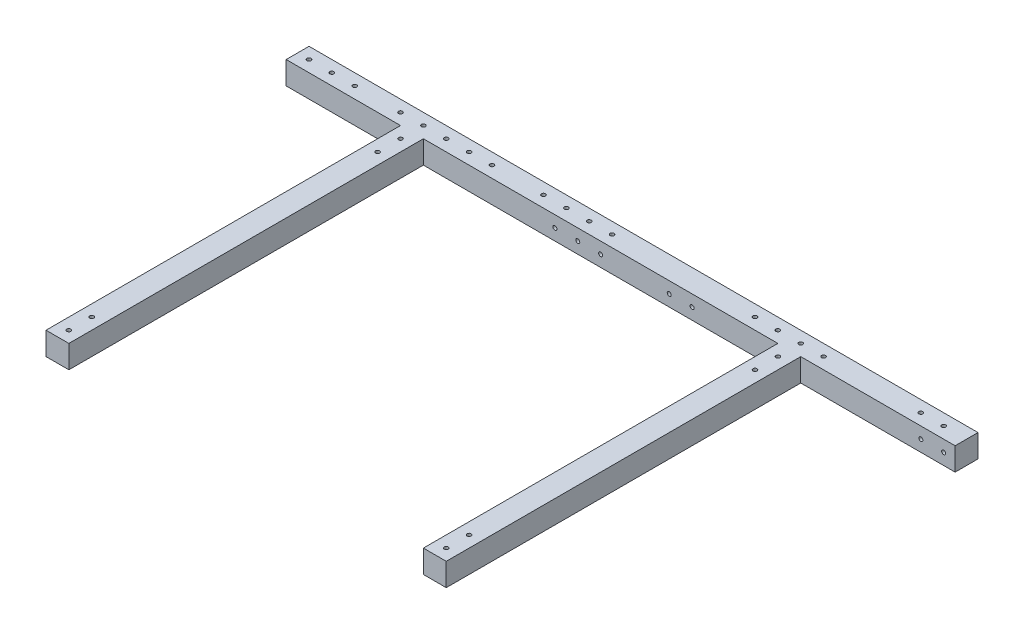
from build123d import *

# Parameters (mm, degrees)
SKETCH_1_W          = 350
SKETCH_1_H          = 20
SKETCH_1_W_2        = 20
SKETCH_1_H_2        = 310
SKETCH_1_W_3        = 100
EXTRUDE_1_DEPTH     = 20
CUT_EXTRUDE_1_REACH = 424.404
SKETCH_2_R          = 1.75
SKETCH_3_W          = 20
SKETCH_3_H          = 20
EXTRUDE_2_DEPTH     = 135
SKETCH_4_R          = 1.75
CUT_EXTRUDE_2_DEPTH = 20
CUT_EXTRUDE_3_REACH = 455.211
SKETCH_5_R          = 1.75
CUT_EXTRUDE_4_REACH = 455.211
SKETCH_6_R          = 1.75
SKETCH_7_R          = 1.75
CUT_EXTRUDE_5_DEPTH = 20
SKETCH_8_R          = 1.75
CUT_EXTRUDE_6_DEPTH = 20


with BuildPart() as part:
    # 草图1 → 凸台-拉伸1 (new body)
    with BuildSketch(Plane(origin=(0, 0, 0), x_dir=(1, 0, 0), z_dir=(0, 1, 0))):
        Rectangle(SKETCH_1_W, SKETCH_1_H)
        with Locations((-165, -165)):
            Rectangle(SKETCH_1_W_2, SKETCH_1_H_2)
        with Locations((165, -165)):
            Rectangle(SKETCH_1_W_2, SKETCH_1_H_2)
        with Locations((-225, 0)):
            Rectangle(SKETCH_1_W_3, SKETCH_1_H)
    extrude(amount=EXTRUDE_1_DEPTH)

    # 草图2 → 切除-拉伸1 (cut, up to next)
    with BuildSketch(Plane(origin=(0, 20, 0), x_dir=(1, 0, 0), z_dir=(0, 1, 0)), mode=Mode.PRIVATE) as cut_extrude_1_sk1:
        with Locations(Location((-145, 0, 0), (0, 0, 270))):
            Circle(SKETCH_2_R)
    cut_extrude_1_tool1 = extrude(cut_extrude_1_sk1.sketch, amount=-CUT_EXTRUDE_1_REACH, mode=Mode.PRIVATE) & part.part
    # 草图2 → 切除-拉伸1 (cut, up to next)
    with BuildSketch(Plane(origin=(0, 20, 0), x_dir=(1, 0, 0), z_dir=(0, 1, 0)), mode=Mode.PRIVATE) as cut_extrude_1_sk2:
        with Locations(Location((-125, 0, 0), (0, 0, 270))):
            Circle(SKETCH_2_R)
    cut_extrude_1_tool2 = extrude(cut_extrude_1_sk2.sketch, amount=-CUT_EXTRUDE_1_REACH, mode=Mode.PRIVATE) & part.part
    # 草图2 → 切除-拉伸1 (cut, up to next)
    with BuildSketch(Plane(origin=(0, 20, 0), x_dir=(1, 0, 0), z_dir=(0, 1, 0)), mode=Mode.PRIVATE) as cut_extrude_1_sk3:
        with Locations(Location((-165, -310, 0), (0, 0, 270))):
            Circle(SKETCH_2_R)
    cut_extrude_1_tool3 = extrude(cut_extrude_1_sk3.sketch, amount=-CUT_EXTRUDE_1_REACH, mode=Mode.PRIVATE) & part.part
    # 草图2 → 切除-拉伸1 (cut, up to next)
    with BuildSketch(Plane(origin=(0, 20, 0), x_dir=(1, 0, 0), z_dir=(0, 1, 0)), mode=Mode.PRIVATE) as cut_extrude_1_sk4:
        with Locations(Location((125, 0, 0), (0, 0, 270))):
            Circle(SKETCH_2_R)
    cut_extrude_1_tool4 = extrude(cut_extrude_1_sk4.sketch, amount=-CUT_EXTRUDE_1_REACH, mode=Mode.PRIVATE) & part.part
    # 草图2 → 切除-拉伸1 (cut, up to next)
    with BuildSketch(Plane(origin=(0, 20, 0), x_dir=(1, 0, 0), z_dir=(0, 1, 0)), mode=Mode.PRIVATE) as cut_extrude_1_sk5:
        with Locations(Location((145, 0, 0), (0, 0, 270))):
            Circle(SKETCH_2_R)
    cut_extrude_1_tool5 = extrude(cut_extrude_1_sk5.sketch, amount=-CUT_EXTRUDE_1_REACH, mode=Mode.PRIVATE) & part.part
    # 草图2 → 切除-拉伸1 (cut, up to next)
    with BuildSketch(Plane(origin=(0, 20, 0), x_dir=(1, 0, 0), z_dir=(0, 1, 0)), mode=Mode.PRIVATE) as cut_extrude_1_sk6:
        with Locations(Location((165, 0, 0), (0, 0, 270))):
            Circle(SKETCH_2_R)
    cut_extrude_1_tool6 = extrude(cut_extrude_1_sk6.sketch, amount=-CUT_EXTRUDE_1_REACH, mode=Mode.PRIVATE) & part.part
    # 草图2 → 切除-拉伸1 (cut, up to next)
    with BuildSketch(Plane(origin=(0, 20, 0), x_dir=(1, 0, 0), z_dir=(0, 1, 0)), mode=Mode.PRIVATE) as cut_extrude_1_sk7:
        with Locations(Location((165, -20, 0), (0, 0, 270))):
            Circle(SKETCH_2_R)
    cut_extrude_1_tool7 = extrude(cut_extrude_1_sk7.sketch, amount=-CUT_EXTRUDE_1_REACH, mode=Mode.PRIVATE) & part.part
    # 草图2 → 切除-拉伸1 (cut, up to next)
    with BuildSketch(Plane(origin=(0, 20, 0), x_dir=(1, 0, 0), z_dir=(0, 1, 0)), mode=Mode.PRIVATE) as cut_extrude_1_sk8:
        with Locations(Location((165, -290, 0), (0, 0, 270))):
            Circle(SKETCH_2_R)
    cut_extrude_1_tool8 = extrude(cut_extrude_1_sk8.sketch, amount=-CUT_EXTRUDE_1_REACH, mode=Mode.PRIVATE) & part.part
    # 草图2 → 切除-拉伸1 (cut, up to next)
    with BuildSketch(Plane(origin=(0, 20, 0), x_dir=(1, 0, 0), z_dir=(0, 1, 0)), mode=Mode.PRIVATE) as cut_extrude_1_sk9:
        with Locations(Location((165, -310, 0), (0, 0, 270))):
            Circle(SKETCH_2_R)
    cut_extrude_1_tool9 = extrude(cut_extrude_1_sk9.sketch, amount=-CUT_EXTRUDE_1_REACH, mode=Mode.PRIVATE) & part.part
    # 草图2 → 切除-拉伸1 (cut, up to next)
    with BuildSketch(Plane(origin=(0, 20, 0), x_dir=(1, 0, 0), z_dir=(0, 1, 0)), mode=Mode.PRIVATE) as cut_extrude_1_sk10:
        with Locations(Location((-105, 0, 0), (0, 0, 270))):
            Circle(SKETCH_2_R)
    cut_extrude_1_tool10 = extrude(cut_extrude_1_sk10.sketch, amount=-CUT_EXTRUDE_1_REACH, mode=Mode.PRIVATE) & part.part
    # 草图2 → 切除-拉伸1 (cut, up to next)
    with BuildSketch(Plane(origin=(0, 20, 0), x_dir=(1, 0, 0), z_dir=(0, 1, 0)), mode=Mode.PRIVATE) as cut_extrude_1_sk11:
        with Locations(Location((-165, 0, 0), (0, 0, 270))):
            Circle(SKETCH_2_R)
    cut_extrude_1_tool11 = extrude(cut_extrude_1_sk11.sketch, amount=-CUT_EXTRUDE_1_REACH, mode=Mode.PRIVATE) & part.part
    # 草图2 → 切除-拉伸1 (cut, up to next)
    with BuildSketch(Plane(origin=(0, 20, 0), x_dir=(1, 0, 0), z_dir=(0, 1, 0)), mode=Mode.PRIVATE) as cut_extrude_1_sk12:
        with Locations(Location((-165, -20, 0), (0, 0, 270))):
            Circle(SKETCH_2_R)
    cut_extrude_1_tool12 = extrude(cut_extrude_1_sk12.sketch, amount=-CUT_EXTRUDE_1_REACH, mode=Mode.PRIVATE) & part.part
    # 草图2 → 切除-拉伸1 (cut, up to next)
    with BuildSketch(Plane(origin=(0, 20, 0), x_dir=(1, 0, 0), z_dir=(0, 1, 0)), mode=Mode.PRIVATE) as cut_extrude_1_sk13:
        with Locations(Location((-165, -290, 0), (0, 0, 270))):
            Circle(SKETCH_2_R)
    cut_extrude_1_tool13 = extrude(cut_extrude_1_sk13.sketch, amount=-CUT_EXTRUDE_1_REACH, mode=Mode.PRIVATE) & part.part
    # 草图2 → 切除-拉伸1 (cut, up to next)
    with BuildSketch(Plane(origin=(0, 20, 0), x_dir=(1, 0, 0), z_dir=(0, 1, 0)), mode=Mode.PRIVATE) as cut_extrude_1_sk14:
        with Locations(Location((-185, 0, 0), (0, 0, 270))):
            Circle(SKETCH_2_R)
    cut_extrude_1_tool14 = extrude(cut_extrude_1_sk14.sketch, amount=-CUT_EXTRUDE_1_REACH, mode=Mode.PRIVATE) & part.part
    # 草图2 → 切除-拉伸1 (cut, up to next)
    with BuildSketch(Plane(origin=(0, 20, 0), x_dir=(1, 0, 0), z_dir=(0, 1, 0)), mode=Mode.PRIVATE) as cut_extrude_1_sk15:
        with Locations(Location((-165, -40, 0), (0, 0, 270))):
            Circle(SKETCH_2_R)
    cut_extrude_1_tool15 = extrude(cut_extrude_1_sk15.sketch, amount=-CUT_EXTRUDE_1_REACH, mode=Mode.PRIVATE) & part.part
    add(cut_extrude_1_tool1.solids().sort_by_distance((-145, 20, 0))[0], mode=Mode.SUBTRACT)
    add(cut_extrude_1_tool2.solids().sort_by_distance((-125, 20, 0))[0], mode=Mode.SUBTRACT)
    add(cut_extrude_1_tool3.solids().sort_by_distance((-165, 20, 310))[0], mode=Mode.SUBTRACT)
    add(cut_extrude_1_tool4.solids().sort_by_distance((125, 20, 0))[0], mode=Mode.SUBTRACT)
    add(cut_extrude_1_tool5.solids().sort_by_distance((145, 20, 0))[0], mode=Mode.SUBTRACT)
    add(cut_extrude_1_tool6.solids().sort_by_distance((165, 20, 0))[0], mode=Mode.SUBTRACT)
    add(cut_extrude_1_tool7.solids().sort_by_distance((165, 20, 20))[0], mode=Mode.SUBTRACT)
    add(cut_extrude_1_tool8.solids().sort_by_distance((165, 20, 290))[0], mode=Mode.SUBTRACT)
    add(cut_extrude_1_tool9.solids().sort_by_distance((165, 20, 310))[0], mode=Mode.SUBTRACT)
    add(cut_extrude_1_tool10.solids().sort_by_distance((-105, 20, 0))[0], mode=Mode.SUBTRACT)
    add(cut_extrude_1_tool11.solids().sort_by_distance((-165, 20, 0))[0], mode=Mode.SUBTRACT)
    add(cut_extrude_1_tool12.solids().sort_by_distance((-165, 20, 20))[0], mode=Mode.SUBTRACT)
    add(cut_extrude_1_tool13.solids().sort_by_distance((-165, 20, 290))[0], mode=Mode.SUBTRACT)
    add(cut_extrude_1_tool14.solids().sort_by_distance((-185, 20, 0))[0], mode=Mode.SUBTRACT)
    add(cut_extrude_1_tool15.solids().sort_by_distance((-165, 20, 40))[0], mode=Mode.SUBTRACT)

    # 草图3 → 凸台-拉伸2 (add)
    with BuildSketch(Plane(origin=(175, 0, 0), x_dir=(0, 0, -1), z_dir=(1, 0, 0))):
        with Locations((0, 10)):
            Rectangle(SKETCH_3_W, SKETCH_3_H)
    extrude(amount=EXTRUDE_2_DEPTH)

    # 草图4 → 切除-拉伸2 (cut)
    with BuildSketch(Plane(origin=(0, 20, 0), x_dir=(1, 0, 0), z_dir=(0, 1, 0))):
        with Locations(Location((165, -40, 0), (0, 0, 270))):
            Circle(SKETCH_4_R)
        with Locations(Location((185, 0, 0), (0, 0, 270))):
            Circle(SKETCH_4_R)
    extrude(amount=-CUT_EXTRUDE_2_DEPTH, mode=Mode.SUBTRACT)

    # 草图5 → 切除-拉伸3 (cut, up to next)
    with BuildSketch(Plane(origin=(0, 0, -10), x_dir=(-1, 0, 0), z_dir=(0, 0, -1)), mode=Mode.PRIVATE) as cut_extrude_3_sk1:
        with Locations((40, 10)):
            Circle(SKETCH_5_R)
    cut_extrude_3_tool1 = extrude(cut_extrude_3_sk1.sketch, amount=-CUT_EXTRUDE_3_REACH, mode=Mode.PRIVATE) & part.part
    # 草图5 → 切除-拉伸3 (cut, up to next)
    with BuildSketch(Plane(origin=(0, 0, -10), x_dir=(-1, 0, 0), z_dir=(0, 0, -1)), mode=Mode.PRIVATE) as cut_extrude_3_sk2:
        with Locations((20, 10)):
            Circle(SKETCH_5_R)
    cut_extrude_3_tool2 = extrude(cut_extrude_3_sk2.sketch, amount=-CUT_EXTRUDE_3_REACH, mode=Mode.PRIVATE) & part.part
    # 草图5 → 切除-拉伸3 (cut, up to next)
    with BuildSketch(Plane(origin=(0, 0, -10), x_dir=(-1, 0, 0), z_dir=(0, 0, -1)), mode=Mode.PRIVATE) as cut_extrude_3_sk3:
        with Locations((0, 10)):
            Circle(SKETCH_5_R)
    cut_extrude_3_tool3 = extrude(cut_extrude_3_sk3.sketch, amount=-CUT_EXTRUDE_3_REACH, mode=Mode.PRIVATE) & part.part
    add(cut_extrude_3_tool1.solids().sort_by_distance((-40, 10, -10))[0], mode=Mode.SUBTRACT)
    add(cut_extrude_3_tool2.solids().sort_by_distance((-20, 10, -10))[0], mode=Mode.SUBTRACT)
    add(cut_extrude_3_tool3.solids().sort_by_distance((0, 10, -10))[0], mode=Mode.SUBTRACT)

    # 草图6 → 切除-拉伸4 (cut, up to next)
    with BuildSketch(Plane(origin=(0, 0, -10), x_dir=(-1, 0, 0), z_dir=(0, 0, -1)), mode=Mode.PRIVATE) as cut_extrude_4_sk1:
        with Locations((-300, 10)):
            Circle(SKETCH_6_R)
    cut_extrude_4_tool1 = extrude(cut_extrude_4_sk1.sketch, amount=-CUT_EXTRUDE_4_REACH, mode=Mode.PRIVATE) & part.part
    # 草图6 → 切除-拉伸4 (cut, up to next)
    with BuildSketch(Plane(origin=(0, 0, -10), x_dir=(-1, 0, 0), z_dir=(0, 0, -1)), mode=Mode.PRIVATE) as cut_extrude_4_sk2:
        with Locations((-280, 10)):
            Circle(SKETCH_6_R)
    cut_extrude_4_tool2 = extrude(cut_extrude_4_sk2.sketch, amount=-CUT_EXTRUDE_4_REACH, mode=Mode.PRIVATE) & part.part
    add(cut_extrude_4_tool1.solids().sort_by_distance((300, 10, -10))[0], mode=Mode.SUBTRACT)
    add(cut_extrude_4_tool2.solids().sort_by_distance((280, 10, -10))[0], mode=Mode.SUBTRACT)

    # 草图7 → 切除-拉伸5 (cut)
    with BuildSketch(Plane(origin=(0, 0, -10), x_dir=(-1, 0, 0), z_dir=(0, 0, -1))):
        with Locations((-80, 10)):
            Circle(SKETCH_7_R)
        with Locations((-60, 10)):
            Circle(SKETCH_7_R)
    extrude(amount=-CUT_EXTRUDE_5_DEPTH, mode=Mode.SUBTRACT)

    # 草图8 → 切除-拉伸6 (cut)
    with BuildSketch(Plane.XZ):
        with Locations(Location((-60, 0, 0), (0, 0, 270))):
            Circle(SKETCH_8_R)
        with Locations(Location((-40, 0, 0), (0, 0, 270))):
            Circle(SKETCH_8_R)
        with Locations(Location((-20, 0, 0), (0, 0, 270))):
            Circle(SKETCH_8_R)
        with Locations(Location((0, 0, 0), (0, 0, 270))):
            Circle(SKETCH_8_R)
        with Locations(Location((290, 0, 0), (0, 0, 270))):
            Circle(SKETCH_8_R)
        with Locations(Location((270, 0, 0), (0, 0, 270))):
            Circle(SKETCH_8_R)
        with Locations(Location((-265, 0, 0), (0, 0, 270))):
            Circle(SKETCH_8_R)
        with Locations(Location((-245, 0, 0), (0, 0, 270))):
            Circle(SKETCH_8_R)
        with Locations(Location((-225, 0, 0), (0, 0, 270))):
            Circle(SKETCH_8_R)
    extrude(amount=-CUT_EXTRUDE_6_DEPTH, mode=Mode.SUBTRACT)


solid = part.part
